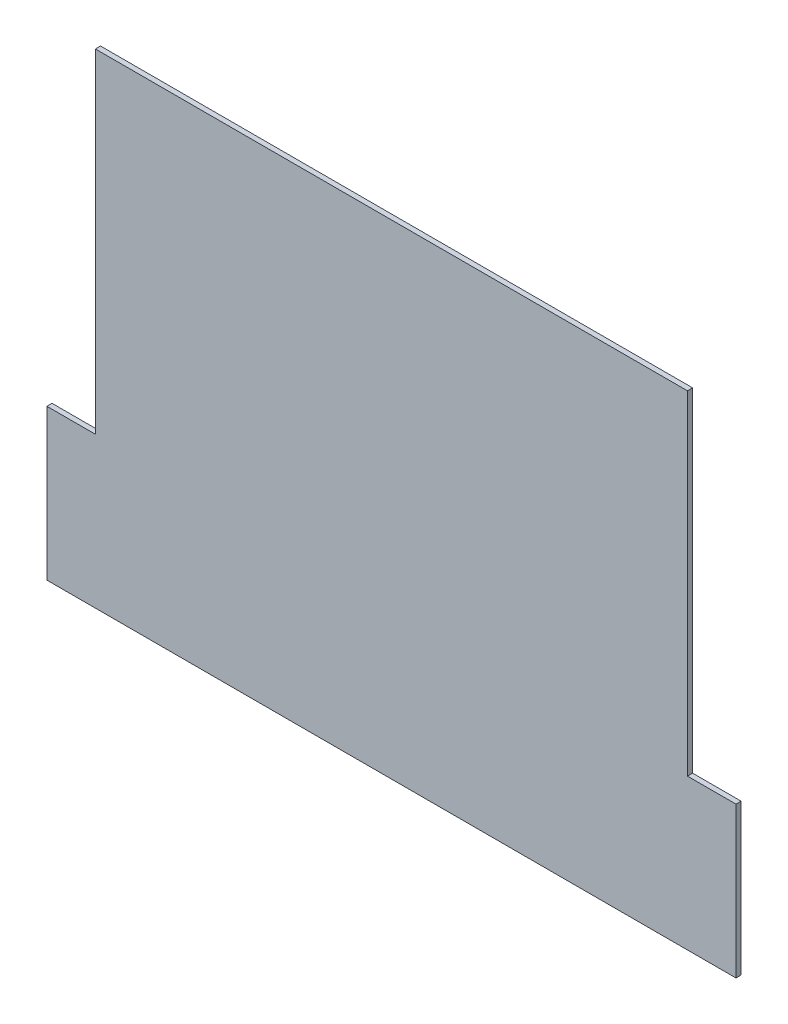
from build123d import *

# Parameters (mm, degrees)
BOSS_EXTRUDE1_DEPTH = 3


with BuildPart() as part:
    # Sketch1 → Boss-Extrude1 (new body)
    with BuildSketch(Plane.XY):
        Polygon((0, 0), (402.7, 0), (402.7, 88), (374.35, 88), (374.35, 283), (28.35, 283), (28.35, 88), (0, 88), align=None)
    extrude(amount=BOSS_EXTRUDE1_DEPTH)


solid = part.part
